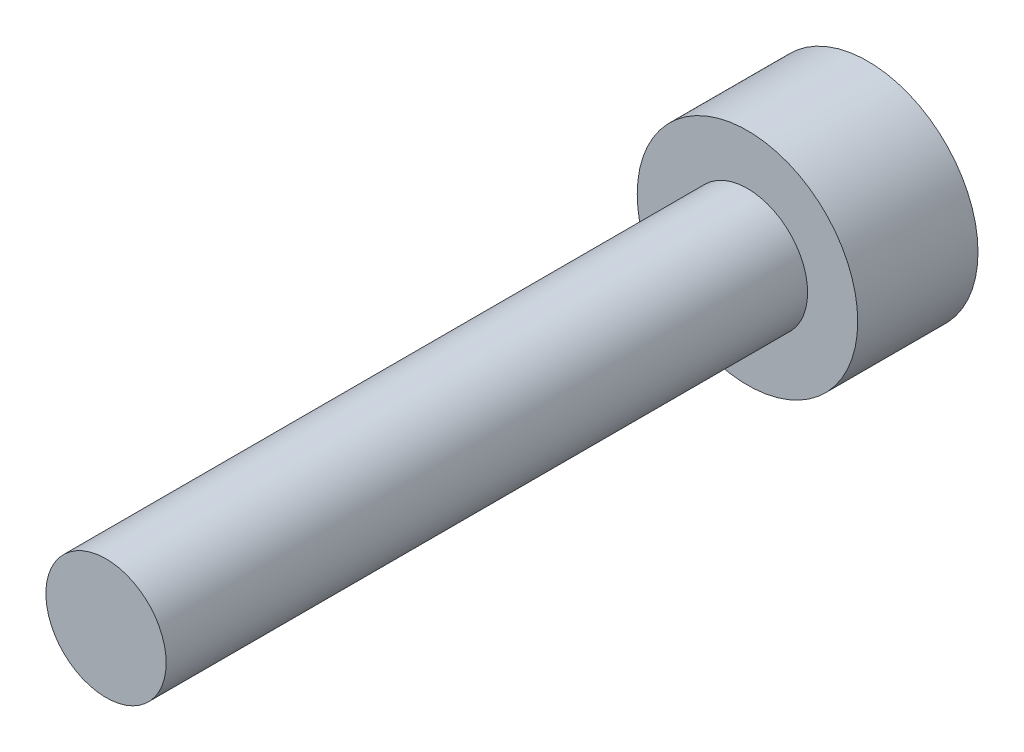
from build123d import *

# Parameters (mm, degrees)
CABEZA_START            = -3
CROQUIS1_R              = 2.75
CABEZA_DEPTH            = 3
CROQUIS2_R              = 1.5
CUERPO_DEPTH            = 16
HEXAGONO_INTERIOR_START = -3
HEXAGONO_INTERIOR_DEPTH = 1.3


with BuildPart() as part:
    # Croquis1 → Cabeza (new body)
    with BuildSketch(Plane.XY.offset(CABEZA_START)):
        Circle(CROQUIS1_R)
    extrude(amount=CABEZA_DEPTH)

    # Croquis2 → Cuerpo (add)
    with BuildSketch(Plane.XY):
        Circle(CROQUIS2_R)
    extrude(amount=CUERPO_DEPTH)

    # Croquis3 → Hexagono_interior (cut)
    with BuildSketch(Plane.XY.offset(HEXAGONO_INTERIOR_START)):
        Polygon((1.443375673, 0), (0.721687836, 1.25), (-0.721687836, 1.25), (-1.443375673, 0), (-0.721687836, -1.25), (0.721687836, -1.25), align=None)
    extrude(amount=HEXAGONO_INTERIOR_DEPTH, mode=Mode.SUBTRACT)


solid = part.part
